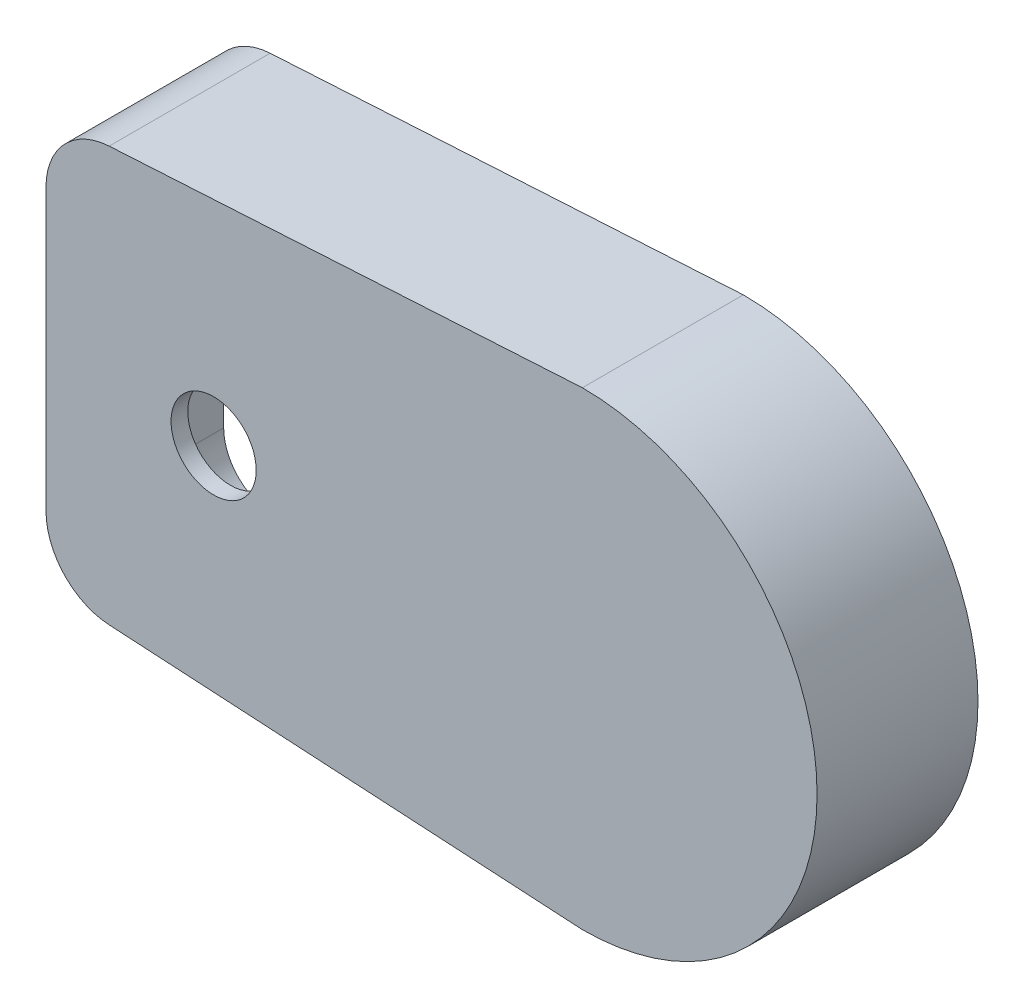
from build123d import *

# Parameters (mm, degrees)
BOSS_EXTRUDE1_DEPTH = 24
CUT_EXTRUDE1_DEPTH  = 43
SKETCH7_R           = 12.7
CUT_EXTRUDE4_DEPTH  = 10


with BuildPart() as part:
    # Sketch1 → Boss-Extrude1 (new, symmetric)
    with BuildSketch(Plane.XY):
        with BuildLine():
            Line((0, 41.872855029), (0, -41.872855029))
            ThreePointArc((0, -41.872855029), (5.455474373, -55.600810969), (18.845677428, -61.839515726))
            Line((18.845677428, -61.839515726), (160, -70))
            ThreePointArc((160, -70), (230, 0), (160, 70))
            Line((160, 70), (18.845677428, 61.839515726))
            ThreePointArc((18.845677428, 61.839515726), (5.455474373, 55.600810969), (0, 41.872855029))
        make_face()
    extrude(amount=BOSS_EXTRUDE1_DEPTH, both=True)

    # Sketch2 → Cut-Extrude1 (cut)
    with BuildSketch(Plane(origin=(0, 0, -24), x_dir=(-1, 0, 0), z_dir=(0, 0, -1))):
        with BuildLine():
            Line((-19.134258071, 56.847850552), (-160.141737643, 64.999845465))
            ThreePointArc((-160.141737643, 64.999845465), (-225, 0), (-160.141737643, -64.999845465))
            Line((-160.141737643, -64.999845465), (-19.134258071, -56.847850552))
            ThreePointArc((-19.134258071, -56.847850552), (-9.09160578, -52.168821984), (-5, -41.872855029))
            Line((-5, -41.872855029), (-5, 41.872855029))
            ThreePointArc((-5, 41.872855029), (-9.09160578, 52.168821984), (-19.134258071, 56.847850552))
        make_face()
    extrude(amount=-CUT_EXTRUDE1_DEPTH, mode=Mode.SUBTRACT)

    # Sketch7 → Cut-Extrude4 (cut)
    with BuildSketch(Plane.XY.offset(24)):
        with Locations((50, 0)):
            Circle(SKETCH7_R)
    extrude(amount=-CUT_EXTRUDE4_DEPTH, mode=Mode.SUBTRACT)


solid = part.part
